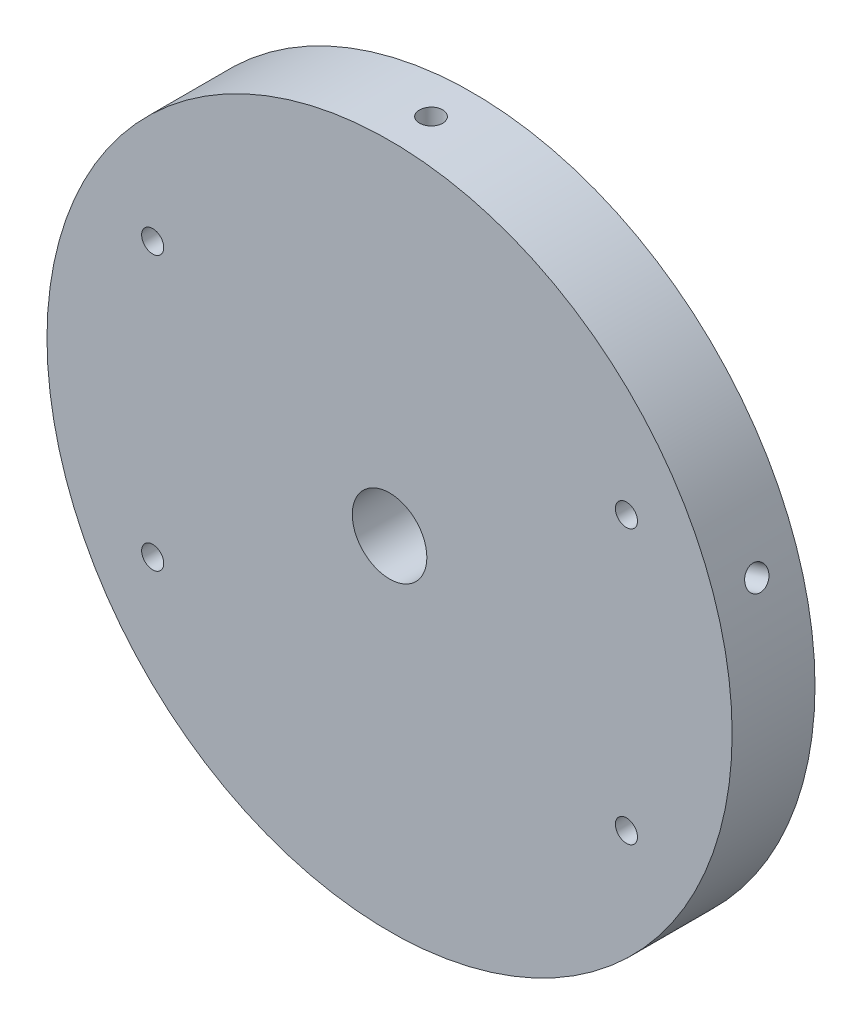
from build123d import *

# Parameters (mm, degrees)
SKETCH1_R                       = 62
BOSS_EXTRUDE1_DEPTH             = 15
F_4_0_4_DIAMETER_HOLE1_D        = 4
M12_CLEARANCE_HOLE1_D           = 13.5
M5_TAPPED_HOLE1_D               = 4.2
M5_TAPPED_HOLE1_DEPTH           = 12.4
M5_TAPPED_HOLE1_TIP             = 1.2618073
M5_TAPPED_HOLE1_ON_FACE_2_D     = 4.2
M5_TAPPED_HOLE1_ON_FACE_2_DEPTH = 12.4
M5_TAPPED_HOLE1_ON_FACE_2_TIP   = 1.2618073
M5_TAPPED_HOLE1_ON_FACE_3_D     = 4.2
M5_TAPPED_HOLE1_ON_FACE_3_DEPTH = 12.4
M5_TAPPED_HOLE1_ON_FACE_3_TIP   = 1.2618073
M5_TAPPED_HOLE1_ON_FACE_4_D     = 4.2
M5_TAPPED_HOLE1_ON_FACE_4_DEPTH = 12.4
M5_TAPPED_HOLE1_ON_FACE_4_TIP   = 1.2618073
M5_TAPPED_HOLE1_ON_FACE_5_D     = 4.2
M5_TAPPED_HOLE1_ON_FACE_5_DEPTH = 12.4
M5_TAPPED_HOLE1_ON_FACE_5_TIP   = 1.2618073


with BuildPart() as part:
    # Sketch1 → Boss-Extrude1 (new body)
    with BuildSketch(Plane.XY):
        Circle(SKETCH1_R)
    extrude(amount=BOSS_EXTRUDE1_DEPTH)

    # Ø4.0 (4) Diameter Hole1 (through all)
    with Locations(Plane(origin=(0, 0, 0), x_dir=(-1, 0, 0), z_dir=(0, 0, -1))):
        with Locations((-42.868257487, 24.75), (-42.868257487, -24.75), (42.868257487, -24.75), (42.868257487, 24.75)):
            Hole(F_4_0_4_DIAMETER_HOLE1_D / 2)

    # M12 Clearance Hole1 (through all)
    with Locations(Plane(origin=(0, 0, 0), x_dir=(-1, 0, 0), z_dir=(0, 0, -1))):
        with Locations((0, 0)):
            Hole(M12_CLEARANCE_HOLE1_D / 2)

    # M5 Tapped Hole1
    with Locations(Plane(origin=(0, 62, 7.5), x_dir=(1, 0, 0), z_dir=(0, 1, 0))):
        with Locations((0, 0)):
            Hole(M5_TAPPED_HOLE1_D / 2, depth=M5_TAPPED_HOLE1_DEPTH)
            with Locations((0, 0, -(M5_TAPPED_HOLE1_DEPTH + M5_TAPPED_HOLE1_TIP / 2))):  # 118° drill point
                Cone(0, M5_TAPPED_HOLE1_D / 2, M5_TAPPED_HOLE1_TIP, mode=Mode.SUBTRACT)

    # M5 Tapped Hole1 on face 2
    with Locations(Plane(origin=(58.96550401, 19.159053651, 7.5), x_dir=(-0.309016857306, 0.951056560832, 0), z_dir=(0.951056560832, 0.309016857306, 0))):
        with Locations((0, 0)):
            Hole(M5_TAPPED_HOLE1_ON_FACE_2_D / 2, depth=M5_TAPPED_HOLE1_ON_FACE_2_DEPTH)
            with Locations((0, 0, -(M5_TAPPED_HOLE1_ON_FACE_2_DEPTH + M5_TAPPED_HOLE1_ON_FACE_2_TIP / 2))):  # 118° drill point
                Cone(0, M5_TAPPED_HOLE1_ON_FACE_2_D / 2, M5_TAPPED_HOLE1_ON_FACE_2_TIP, mode=Mode.SUBTRACT)

    # M5 Tapped Hole1 on face 3
    with Locations(Plane(origin=(36.442685642, -50.159053651, 7.5), x_dir=(-0.809017116291, -0.58778508449, 0), z_dir=(0.58778508449, -0.809017116291, 0))):
        with Locations((0, 0)):
            Hole(M5_TAPPED_HOLE1_ON_FACE_3_D / 2, depth=M5_TAPPED_HOLE1_ON_FACE_3_DEPTH)
            with Locations((0, 0, -(M5_TAPPED_HOLE1_ON_FACE_3_DEPTH + M5_TAPPED_HOLE1_ON_FACE_3_TIP / 2))):  # 118° drill point
                Cone(0, M5_TAPPED_HOLE1_ON_FACE_3_D / 2, M5_TAPPED_HOLE1_ON_FACE_3_TIP, mode=Mode.SUBTRACT)

    # M5 Tapped Hole1 on face 4
    with Locations(Plane(origin=(-36.442685642, -50.159053651, 7.5), x_dir=(-0.809017116291, 0.58778508449, 0), z_dir=(-0.58778508449, -0.809017116291, 0))):
        with Locations((0, 0)):
            Hole(M5_TAPPED_HOLE1_ON_FACE_4_D / 2, depth=M5_TAPPED_HOLE1_ON_FACE_4_DEPTH)
            with Locations((0, 0, -(M5_TAPPED_HOLE1_ON_FACE_4_DEPTH + M5_TAPPED_HOLE1_ON_FACE_4_TIP / 2))):  # 118° drill point
                Cone(0, M5_TAPPED_HOLE1_ON_FACE_4_D / 2, M5_TAPPED_HOLE1_ON_FACE_4_TIP, mode=Mode.SUBTRACT)

    # M5 Tapped Hole1 on face 5
    with Locations(Plane(origin=(-58.96550401, 19.159053651, 7.5), x_dir=(-0.309016857306, -0.951056560832, 0), z_dir=(-0.951056560832, 0.309016857306, 0))):
        with Locations((0, 0)):
            Hole(M5_TAPPED_HOLE1_ON_FACE_5_D / 2, depth=M5_TAPPED_HOLE1_ON_FACE_5_DEPTH)
            with Locations((0, 0, -(M5_TAPPED_HOLE1_ON_FACE_5_DEPTH + M5_TAPPED_HOLE1_ON_FACE_5_TIP / 2))):  # 118° drill point
                Cone(0, M5_TAPPED_HOLE1_ON_FACE_5_D / 2, M5_TAPPED_HOLE1_ON_FACE_5_TIP, mode=Mode.SUBTRACT)


solid = part.part
